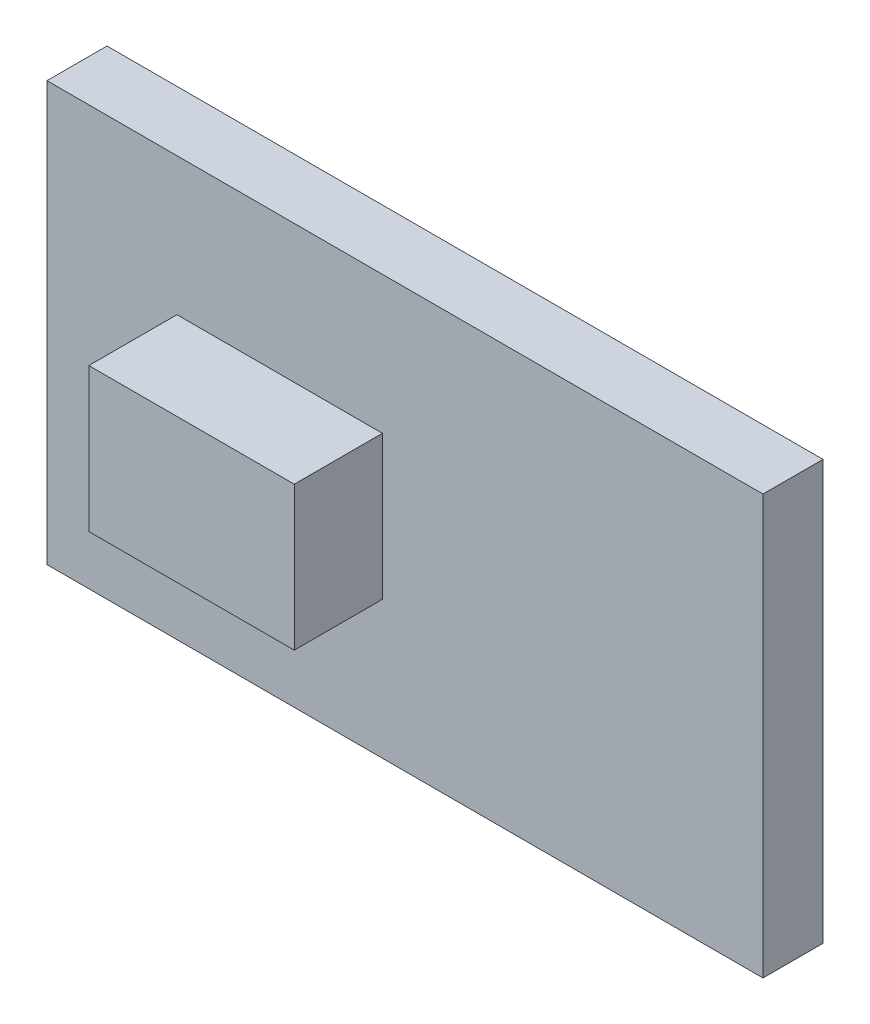
from build123d import *

# Parameters (mm, degrees)
ESQUISSE1_W        = 13
ESQUISSE1_H        = 7.61
BOSS_EXTRU_3_DEPTH = 1.09
ESQUISSE4_W        = 3.73
ESQUISSE4_H        = 2.61
BOSS_EXTRU_4_DEPTH = 1.6


with BuildPart() as part:
    # Esquisse1 → Boss.-Extru.3 (new body)
    with BuildSketch(Plane.XY):
        with Locations((-22.795826716, 3.805)):
            Rectangle(ESQUISSE1_W, ESQUISSE1_H)
    extrude(amount=BOSS_EXTRU_3_DEPTH)

    # Esquisse4 → Boss.-Extru.4 (add)
    with BuildSketch(Plane.XY.offset(1.09)):
        with Locations((-25.070826716, 3.805)):
            Rectangle(ESQUISSE4_W, ESQUISSE4_H)
    extrude(amount=BOSS_EXTRU_4_DEPTH)


solid = part.part
